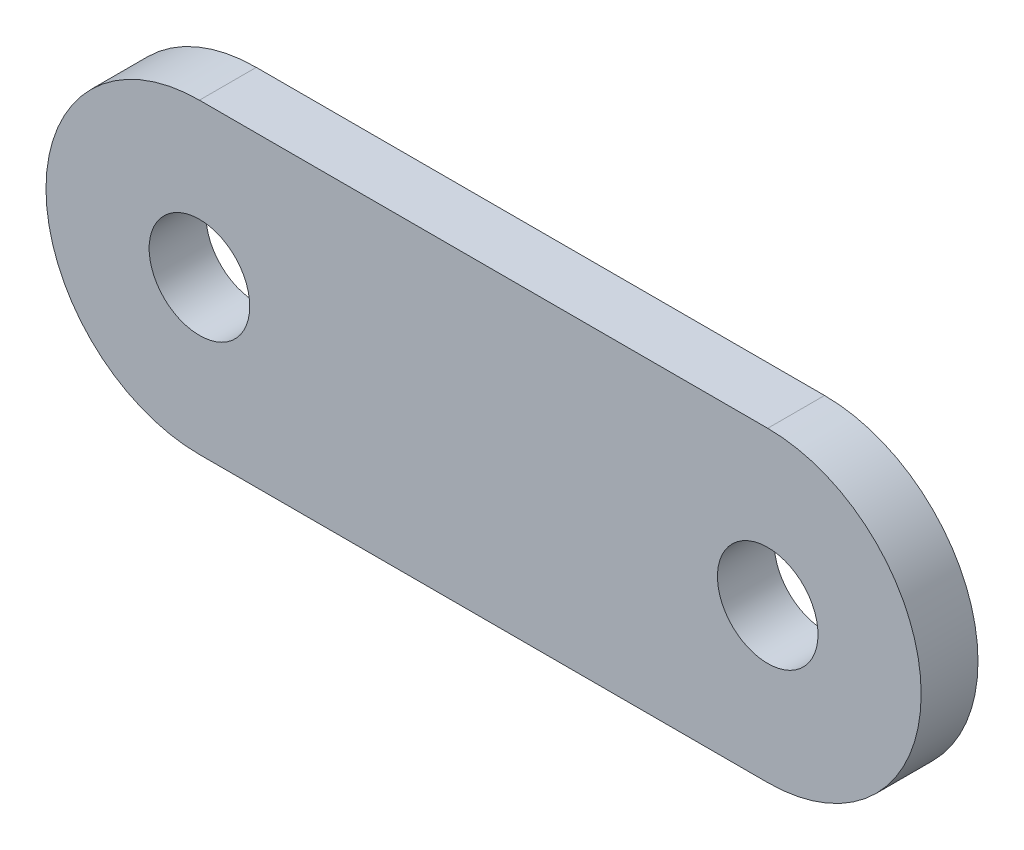
from build123d import *

# Parameters (mm, degrees)
SKETCH1_R           = 4.425
BOSS_EXTRUDE1_DEPTH = 5


with BuildPart() as part:
    # Sketch1 → Boss-Extrude1 (new body)
    with BuildSketch(Plane.XY):
        with BuildLine():
            ThreePointArc((0, 13.5), (-13.5, 0), (0, -13.5))
            Line((0, -13.5), (50, -13.5))
            ThreePointArc((50, -13.5), (63.5, 0), (50, 13.5))
            Line((50, 13.5), (0, 13.5))
        make_face()
        Circle(SKETCH1_R, mode=Mode.SUBTRACT)
        with Locations((50, 0)):
            Circle(SKETCH1_R, mode=Mode.SUBTRACT)
    extrude(amount=BOSS_EXTRUDE1_DEPTH)


solid = part.part
